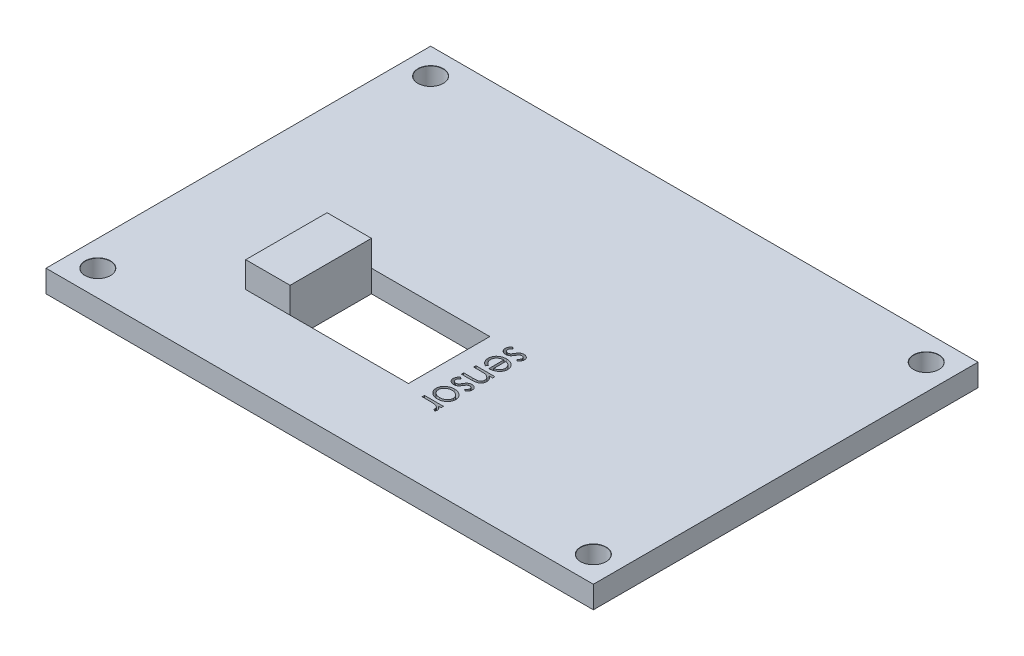
from build123d import *

# Parameters (mm, degrees)
SKETCH1_W                        = 74
SKETCH1_H                        = 52
BOSS_EXTRUDE1_DEPTH              = 3
M3_CLEARANCE_HOLE1_D             = 3.4
M3_CLEARANCE_HOLE1_DEPTH         = 4.5
M3_CLEARANCE_HOLE1_CSINK_D       = 3.45
M3_CLEARANCE_HOLE1_CSINK_ANGLE   = 90
M3_CLEARANCE_HOLE1_TIP           = 1.021463052
SKETCH5_W                        = 16
SKETCH5_H                        = 11
CUT_EXTRUDE1_DEPTH               = 23
SKETCH7_W                        = 6
SKETCH7_H                        = 11
BOSS_EXTRUDE2_DEPTH              = 3.5
M2_5_CLEARANCE_HOLE2_D           = 2.9
M2_5_CLEARANCE_HOLE2_DEPTH       = 5
M2_5_CLEARANCE_HOLE2_CSINK_D     = 2.95
M2_5_CLEARANCE_HOLE2_CSINK_ANGLE = 90
M2_5_CLEARANCE_HOLE2_TIP         = 0.871247898
CUT_EXTRUDE2_DEPTH               = 1


with BuildPart() as part:
    # Sketch1 → Boss-Extrude1 (new body)
    with BuildSketch(Plane(origin=(0, 0, 0), x_dir=(1, 0, 0), z_dir=(0, 1, 0))):
        Rectangle(SKETCH1_W, SKETCH1_H)
    extrude(amount=BOSS_EXTRUDE1_DEPTH)

    # M3 Clearance Hole1
    with Locations(Plane(origin=(0, 3, 0), x_dir=(1, 0, 0), z_dir=(0, 1, 0))):
        with Locations((-33.5, 22.5), (-33.5, -22.5), (33.5, -22.5), (33.5, 22.5)):
            CounterSinkHole(M3_CLEARANCE_HOLE1_D / 2, M3_CLEARANCE_HOLE1_CSINK_D / 2, depth=M3_CLEARANCE_HOLE1_DEPTH, counter_sink_angle=M3_CLEARANCE_HOLE1_CSINK_ANGLE)
            with Locations((0, 0, -(M3_CLEARANCE_HOLE1_DEPTH + M3_CLEARANCE_HOLE1_TIP / 2))):  # 118° drill point
                Cone(0, M3_CLEARANCE_HOLE1_D / 2, M3_CLEARANCE_HOLE1_TIP, mode=Mode.SUBTRACT)

    # Sketch5 → Cut-Extrude1 (cut)
    with BuildSketch(Plane(origin=(0, 3, 0), x_dir=(1, 0, 0), z_dir=(0, 1, 0))):
        with Locations((-7, -9.5)):
            Rectangle(SKETCH5_W, SKETCH5_H)
    extrude(amount=-CUT_EXTRUDE1_DEPTH, mode=Mode.SUBTRACT)

    # Sketch7 → Boss-Extrude2 (add)
    with BuildSketch(Plane(origin=(0, 3, 0), x_dir=(1, 0, 0), z_dir=(0, 1, 0))):
        with Locations((-18, -9.5)):
            Rectangle(SKETCH7_W, SKETCH7_H)
    extrude(amount=BOSS_EXTRUDE2_DEPTH)

    # M2.5 Clearance Hole2
    with Locations(Plane(origin=(0, 0, 0), x_dir=(-1, 0, 0), z_dir=(0, -1, 0))):
        with Locations((19, -6)):
            CounterSinkHole(M2_5_CLEARANCE_HOLE2_D / 2, M2_5_CLEARANCE_HOLE2_CSINK_D / 2, depth=M2_5_CLEARANCE_HOLE2_DEPTH, counter_sink_angle=M2_5_CLEARANCE_HOLE2_CSINK_ANGLE)
            with Locations((0, 0, -(M2_5_CLEARANCE_HOLE2_DEPTH + M2_5_CLEARANCE_HOLE2_TIP / 2))):  # 118° drill point
                Cone(0, M2_5_CLEARANCE_HOLE2_D / 2, M2_5_CLEARANCE_HOLE2_TIP, mode=Mode.SUBTRACT)

    # Sketch14 → Cut-Extrude2 (cut)
    # profile 1 of 6: a face of its own
    with BuildSketch(Plane(origin=(0, 3, 0), x_dir=(1, 0, 0), z_dir=(0, 1, 0))):
        with BuildLine():
            Line((5.713925383, -5.03097691), (5.494474261, -4.843777391))
            add(Edge.make_bspline(
                [(5.494474261, -4.843777391), (5.515784448, -4.825856855), (5.556832378, -4.791338111), (5.611713908, -4.736479415), (5.658182184, -4.681848956), (5.696422524, -4.627755824), (5.726528224, -4.574091737), (5.747795767, -4.520373927), (5.761151642, -4.46675652), (5.762864561, -4.430888026), (5.76370503, -4.413288609)],
                knots=[0, 0, 0, 0, 1.274592799, 2.455135499, 3.548644466, 4.555161242, 5.484465169, 6.358905668, 7.194772355, 8, 8, 8, 8], degree=3))
            add(Edge.make_bspline(
                [(5.76370503, -4.413288609), (5.762631154, -4.391611953), (5.760517627, -4.348949505), (5.739367566, -4.287915875), (5.706947452, -4.231317414), (5.660750029, -4.182638365), (5.60826914, -4.140731123), (5.549070601, -4.110745012), (5.485873996, -4.091372609), (5.441798544, -4.089578667), (5.419454229, -4.088669218)],
                knots=[0, 0, 0, 0, 0.989431907, 1.947329373, 2.925816416, 3.956145657, 5.000994681, 5.98712103, 6.97955893, 8, 8, 8, 8], degree=3))
            add(Edge.make_bspline(
                [(5.419454229, -4.088669218), (5.39926215, -4.089596334), (5.359034548, -4.091443378), (5.29953849, -4.107089947), (5.241734663, -4.132484734), (5.205778555, -4.155910854), (5.187382915, -4.167895981)],
                knots=[0, 0, 0, 0, 0.97148553, 1.935438782, 2.943742038, 4, 4, 4, 4], degree=3))
            add(Edge.make_bspline(
                [(5.187382915, -4.167895981), (5.177627833, -4.17517051), (5.156994093, -4.190557437), (5.127732172, -4.219524952), (5.096345034, -4.252716923), (5.063816862, -4.291829491), (5.030541728, -4.336416008), (4.99620788, -4.38679528), (4.95952469, -4.441767419), (4.935973802, -4.481187866), (4.92376112, -4.501629955)],
                knots=[0, 0, 0, 0, 0.681844013, 1.442221745, 2.304793414, 3.244787667, 4.29358454, 5.424541895, 6.66445591, 8, 8, 8, 8], degree=3))
            add(Edge.make_bspline(
                [(4.92376112, -4.501629955), (4.908496844, -4.526503671), (4.878958855, -4.574636942), (4.833429266, -4.6429191), (4.787861385, -4.70454958), (4.742828046, -4.760324014), (4.698453012, -4.810054098), (4.653755551, -4.853173003), (4.610033108, -4.890664511), (4.579463332, -4.911566737), (4.564786761, -4.92160191)],
                knots=[0, 0, 0, 0, 1.25757375, 2.433538206, 3.535360318, 4.559312813, 5.521998164, 6.405171035, 7.23432147, 8, 8, 8, 8], degree=3))
            add(Edge.make_bspline(
                [(4.564786761, -4.92160191), (4.535074875, -4.938415045), (4.475717546, -4.972003718), (4.378354997, -5.006016139), (4.275661441, -5.026995524), (4.205215135, -5.029633854), (4.169354069, -5.03097691)],
                knots=[0, 0, 0, 0, 0.984436973, 1.96667253, 2.964923853, 4, 4, 4, 4], degree=3))
            add(Edge.make_bspline(
                [(4.169354069, -5.03097691), (4.144085953, -5.030505077), (4.09431302, -5.029575663), (4.021078647, -5.020217691), (3.950960236, -5.004813377), (3.883564989, -4.983595961), (3.819041682, -4.956475833), (3.757840026, -4.922323937), (3.699206732, -4.882967995), (3.644233713, -4.837682096), (3.594156631, -4.787722879), (3.550331952, -4.734239539), (3.513454721, -4.677551886), (3.483354243, -4.617758834), (3.459217723, -4.5551434), (3.442336116, -4.489280799), (3.432504359, -4.420364412), (3.431089916, -4.373356159), (3.430371697, -4.349486525)],
                knots=[0, 0, 0, 0, 1.080990183, 2.129325844, 3.15347647, 4.149949586, 5.149430173, 6.143289453, 7.144770003, 8.168041068, 9.186510088, 10.167552684, 11.121921968, 12.074717509, 13.027670542, 13.988361086, 14.978539299, 16, 16, 16, 16], degree=3))
            add(Edge.make_bspline(
                [(3.430371697, -4.349486525), (3.431375818, -4.317384664), (3.433377319, -4.253396437), (3.451877051, -4.158801751), (3.480706954, -4.066351433), (3.520601652, -3.976880223), (3.570770856, -3.892235574), (3.630887429, -3.814870456), (3.698989409, -3.74447148), (3.750721572, -3.704776569), (3.776725863, -3.684823064)],
                knots=[0, 0, 0, 0, 0.989573484, 1.972504045, 2.962313952, 3.972686715, 4.987987903, 5.990404037, 6.989833111, 8, 8, 8, 8], degree=3))
            Line((3.776725863, -3.684823064), (4.01370503, -3.868516974))
            add(Edge.make_bspline(
                [(4.01370503, -3.868516974), (3.992388056, -3.885951781), (3.951236677, -3.919608824), (3.896057898, -3.973811968), (3.849869388, -4.029206557), (3.811102328, -4.084929873), (3.781663576, -4.14182312), (3.760079199, -4.199394474), (3.746939965, -4.257980788), (3.745293842, -4.297539314), (3.744474261, -4.317234923)],
                knots=[0, 0, 0, 0, 1.219430901, 2.354051827, 3.419706558, 4.410314163, 5.35484724, 6.249024396, 7.128214957, 8, 8, 8, 8], degree=3))
            add(Edge.make_bspline(
                [(3.744474261, -4.317234923), (3.745845603, -4.344073115), (3.748534815, -4.396702995), (3.773230779, -4.471976834), (3.811446996, -4.541730615), (3.865742715, -4.601878092), (3.928418727, -4.653750505), (3.999996467, -4.689030258), (4.075902966, -4.713631728), (4.128954611, -4.715778573), (4.156032754, -4.716874346)],
                knots=[0, 0, 0, 0, 1.00949534, 1.979627371, 2.958171743, 3.988840155, 5.017131362, 6.006571593, 6.982532213, 8, 8, 8, 8], degree=3))
            add(Edge.make_bspline(
                [(4.156032754, -4.716874346), (4.178323837, -4.715970159), (4.222241416, -4.714188743), (4.285916704, -4.698890413), (4.346098079, -4.67440177), (4.381920743, -4.650451554), (4.400023139, -4.638348705)],
                knots=[0, 0, 0, 0, 1.025273956, 2.019980326, 2.999429558, 4, 4, 4, 4], degree=3))
            add(Edge.make_bspline(
                [(4.400023139, -4.638348705), (4.409071703, -4.631053465), (4.428810858, -4.61513913), (4.456815926, -4.585217004), (4.48771532, -4.55037844), (4.520265977, -4.509360124), (4.553407638, -4.461720544), (4.58860468, -4.40811651), (4.625756812, -4.348492471), (4.650649479, -4.306306033), (4.663644934, -4.284282199)],
                knots=[0, 0, 0, 0, 0.628055649, 1.370083424, 2.21210131, 3.147971961, 4.200247531, 5.350348024, 6.616723807, 8, 8, 8, 8], degree=3))
            add(Edge.make_bspline(
                [(4.663644934, -4.284282199), (4.678164342, -4.260315792), (4.706287869, -4.213893795), (4.750464588, -4.148577974), (4.794834794, -4.089687031), (4.838244841, -4.036076896), (4.881469971, -3.988215991), (4.925241801, -3.946739031), (4.968264861, -3.910626852), (4.998361646, -3.890699369), (5.012803588, -3.881137166)],
                knots=[0, 0, 0, 0, 1.250050915, 2.421299963, 3.51612139, 4.53880554, 5.498304292, 6.39070068, 7.22777776, 8, 8, 8, 8], degree=3))
            add(Edge.make_bspline(
                [(5.012803588, -3.881137166), (5.042005962, -3.864427748), (5.100664552, -3.830863665), (5.197937785, -3.799407454), (5.300205609, -3.777434997), (5.37071591, -3.775538244), (5.406834037, -3.774566654)],
                knots=[0, 0, 0, 0, 0.974180598, 1.956829218, 2.953408235, 4, 4, 4, 4], degree=3))
            add(Edge.make_bspline(
                [(5.406834037, -3.774566654), (5.430462862, -3.775083557), (5.476707821, -3.776095212), (5.544547841, -3.784676369), (5.609155664, -3.798946655), (5.671302153, -3.817285198), (5.729571741, -3.843254105), (5.785671468, -3.87318084), (5.837958655, -3.9098879), (5.88699392, -3.951185283), (5.931638638, -3.996256569), (5.970708633, -4.045123721), (6.003387155, -4.097074447), (6.031408137, -4.151455379), (6.052377136, -4.209213516), (6.066853385, -4.269931118), (6.076471329, -4.333288137), (6.077357144, -4.376560426), (6.077807594, -4.398565051)],
                knots=[0, 0, 0, 0, 1.106544246, 2.165663863, 3.196339384, 4.204026465, 5.194439687, 6.179088469, 7.178175954, 8.180377361, 9.178984918, 10.144956361, 11.104642061, 12.049540701, 13.00541004, 13.974539981, 14.970022375, 16, 16, 16, 16], degree=3))
            add(Edge.make_bspline(
                [(6.077807594, -4.398565051), (6.076705012, -4.42482664), (6.074477683, -4.477877741), (6.056702363, -4.5574256), (6.027788766, -4.636748769), (5.986907133, -4.715916514), (5.935515049, -4.795314789), (5.872265038, -4.874545185), (5.798924651, -4.954981591), (5.742915403, -5.005057795), (5.713925383, -5.03097691)],
                knots=[0, 0, 0, 0, 0.83767354, 1.692186424, 2.588965819, 3.526493318, 4.530107962, 5.603187572, 6.759425573, 8, 8, 8, 8], degree=3))
        make_face()
    # profile 2 of 6: a face of its own
    with BuildSketch(Plane(origin=(0, 3, 0), x_dir=(1, 0, 0), z_dir=(0, 1, 0))):
        with BuildLine():
            Line((4.282935799, -7.477891974), (4.136401344, -7.723284602))
            add(Edge.make_bspline(
                [(4.136401344, -7.723284602), (4.097029289, -7.703097244), (4.020715823, -7.6639688), (3.915004168, -7.596801016), (3.820488245, -7.525785488), (3.738388149, -7.448520115), (3.667325996, -7.366600786), (3.604861199, -7.28040054), (3.551753651, -7.189208488), (3.506732002, -7.093050929), (3.472553909, -6.990908339), (3.44796532, -6.882663508), (3.433035343, -6.768073317), (3.431273186, -6.68940923), (3.430371697, -6.649166013)],
                knots=[0, 0, 0, 0, 1.16717717, 2.262298333, 3.300992606, 4.282768172, 5.231436625, 6.159243762, 7.08803444, 8.012493824, 8.956519254, 9.924578845, 10.938249597, 12, 12, 12, 12], degree=3))
            add(Edge.make_bspline(
                [(3.430371697, -6.649166013), (3.431520128, -6.604458451), (3.433761746, -6.51719397), (3.453082786, -6.390204685), (3.484649002, -6.270712689), (3.52863054, -6.158622498), (3.586499837, -6.054439535), (3.655785234, -5.957203994), (3.738992177, -5.868231775), (3.833366276, -5.788007672), (3.934800183, -5.715635066), (4.041349537, -5.65307164), (4.151048348, -5.599612559), (4.263857648, -5.555103288), (4.380122245, -5.52145649), (4.499524233, -5.497737507), (4.622115458, -5.48243169), (4.705199571, -5.480612053), (4.747078428, -5.479694859)],
                knots=[0, 0, 0, 0, 1.089790918, 2.127157792, 3.123915388, 4.098660683, 5.05524143, 6.023214965, 7.003194833, 8.017637841, 9.039275965, 10.038247135, 11.027251055, 12.012602527, 12.991985574, 13.974481355, 14.979029789, 16, 16, 16, 16], degree=3))
            add(Edge.make_bspline(
                [(4.747078428, -5.479694859), (4.786377924, -5.480472927), (4.864247006, -5.482014613), (4.979258175, -5.495223151), (5.091358035, -5.515287136), (5.20016598, -5.544084051), (5.305719609, -5.581287832), (5.407801514, -5.627282006), (5.506883433, -5.680984186), (5.569571345, -5.722948798), (5.601044774, -5.744017775)],
                knots=[0, 0, 0, 0, 1.037955322, 2.056632653, 3.054552807, 4.044494995, 5.026763172, 6.007885755, 6.999828451, 8, 8, 8, 8], degree=3))
            add(Edge.make_bspline(
                [(5.601044774, -5.744017775), (5.638875498, -5.772179668), (5.713060777, -5.827404566), (5.810573393, -5.922301965), (5.893056828, -6.024553466), (5.961110129, -6.133538446), (6.012961551, -6.250584565), (6.051544603, -6.373906279), (6.073161651, -6.504912789), (6.07623824, -6.594402935), (6.077807594, -6.640051429)],
                knots=[0, 0, 0, 0, 1.068622212, 2.095546368, 3.075529915, 4.04178896, 5.000167431, 5.970776925, 6.964903037, 8, 8, 8, 8], degree=3))
            add(Edge.make_bspline(
                [(6.077807594, -6.640051429), (6.076448425, -6.687133477), (6.073779363, -6.779590604), (6.049136182, -6.914311895), (6.009771573, -7.041758712), (5.954850544, -7.162017512), (5.883081768, -7.274552272), (5.795145034, -7.379230658), (5.692556372, -7.477701847), (5.614394061, -7.534412635), (5.574402146, -7.563428833)],
                knots=[0, 0, 0, 0, 1.02844823, 2.019609899, 2.982709647, 3.938299943, 4.900667657, 5.891038968, 6.920945513, 8, 8, 8, 8], degree=3))
            add(Edge.make_bspline(
                [(5.574402146, -7.563428833), (5.544115306, -7.583148539), (5.483415088, -7.62267034), (5.385527171, -7.672362366), (5.282660316, -7.715113734), (5.174103798, -7.750254882), (5.060172017, -7.777617196), (4.940610299, -7.796811385), (4.815605179, -7.809951942), (4.730285832, -7.811989336), (4.686781953, -7.813028192)],
                knots=[0, 0, 0, 0, 0.926290385, 1.856450811, 2.810349228, 3.780787124, 4.779483266, 5.812115659, 6.884409478, 8, 8, 8, 8], degree=3))
            Line((4.686781953, -7.813028192), (4.686781953, -5.793797423))
            add(Edge.make_bspline(
                [(4.686781953, -5.793797423), (4.653077097, -5.79505796), (4.586817246, -5.797536032), (4.490121882, -5.811583887), (4.397752287, -5.830627156), (4.310309139, -5.857987132), (4.228124973, -5.893649364), (4.149603265, -5.934597226), (4.076581764, -5.984409913), (4.008050163, -6.039754015), (3.947023558, -6.10150015), (3.892101744, -6.166026405), (3.846481307, -6.235117427), (3.809005241, -6.307718647), (3.780161069, -6.383732822), (3.759881268, -6.463235317), (3.746756423, -6.5461334), (3.745242848, -6.602841711), (3.744474261, -6.631637968)],
                knots=[0, 0, 0, 0, 1.151551879, 2.263817885, 3.333423249, 4.371325951, 5.38725143, 6.390960548, 7.391934672, 8.402038721, 9.395725498, 10.353641666, 11.292601964, 12.217503998, 13.139886657, 14.063650647, 15.016729413, 16, 16, 16, 16], degree=3))
            add(Edge.make_bspline(
                [(3.744474261, -6.631637968), (3.745103263, -6.659718788), (3.746361092, -6.71587264), (3.757956361, -6.799453631), (3.777039171, -6.881714786), (3.802861407, -6.961913773), (3.834752657, -7.038746665), (3.872722532, -7.110070611), (3.914709236, -7.175876049), (3.963406493, -7.236876364), (4.022161861, -7.296389021), (4.09572254, -7.354902639), (4.183274814, -7.417300841), (4.24829292, -7.456830058), (4.282935799, -7.477891974)],
                knots=[0, 0, 0, 0, 0.95518639, 1.910107873, 2.865062474, 3.825827943, 4.774069364, 5.691941798, 6.572140111, 7.426669854, 8.343335581, 9.411555122, 10.620827491, 12, 12, 12, 12], degree=3))
        make_face()
        with BuildLine():
            add(Edge.make_bspline(
                [(5.000884517, -7.498925628), (5.042478606, -7.48895906), (5.122198513, -7.469856974), (5.233114579, -7.430003928), (5.331792522, -7.38589781), (5.417470972, -7.33291047), (5.493428869, -7.272506028), (5.559699261, -7.202495414), (5.619706813, -7.124676703), (5.669800406, -7.038058491), (5.712327623, -6.9466653), (5.741343907, -6.851018448), (5.760907797, -6.753731946), (5.762770858, -6.687822952), (5.76370503, -6.654774987)],
                knots=[0, 0, 0, 0, 1.241315029, 2.379124576, 3.417805227, 4.374736851, 5.296977, 6.228289518, 7.167729042, 8.144412946, 9.128591931, 10.088239898, 11.041408809, 12, 12, 12, 12], degree=3))
            add(Edge.make_bspline(
                [(5.76370503, -6.654774987), (5.763089866, -6.627629098), (5.761875275, -6.574031849), (5.750489028, -6.495254955), (5.731050213, -6.419611762), (5.705758446, -6.346256875), (5.670432742, -6.276957019), (5.6299404, -6.209416877), (5.580524204, -6.145636881), (5.542970682, -6.106180007), (5.523921376, -6.086165211)],
                knots=[0, 0, 0, 0, 1.026647746, 2.02702864, 3.002800722, 3.978853205, 4.955586324, 5.939775377, 6.954935579, 8, 8, 8, 8], degree=3))
            add(Edge.make_bspline(
                [(5.523921376, -6.086165211), (5.508766749, -6.071824823), (5.477845093, -6.042564548), (5.425310303, -6.00382494), (5.368519855, -5.96627674), (5.305670119, -5.931848141), (5.237086456, -5.900668642), (5.163336545, -5.871944103), (5.084206064, -5.845820241), (5.02923988, -5.830927332), (5.000884517, -5.823244538)],
                knots=[0, 0, 0, 0, 0.844871503, 1.723884476, 2.640765681, 3.603098289, 4.624542049, 5.692238256, 6.809496755, 8, 8, 8, 8], degree=3))
            Line((5.000884517, -5.823244538), (5.000884517, -7.498925628))
        make_face(mode=Mode.SUBTRACT)
    # profile 3 of 6: a face of its own
    with BuildSketch(Plane(origin=(0, 3, 0), x_dir=(1, 0, 0), z_dir=(0, 1, 0))):
        with BuildLine():
            Line((6.032935799, -8.351489731), (6.032935799, -8.665592295))
            Line((6.032935799, -8.665592295), (5.571597658, -8.665592295))
            add(Edge.make_bspline(
                [(5.571597658, -8.665592295), (5.613352036, -8.694205426), (5.693922508, -8.749418163), (5.800511959, -8.84284033), (5.888395766, -8.941705452), (5.958911014, -9.044845393), (6.011992554, -9.152982643), (6.050297039, -9.26528307), (6.073285497, -9.382608192), (6.07629056, -9.462433724), (6.077807594, -9.502731718)],
                knots=[0, 0, 0, 0, 1.186112635, 2.288757738, 3.313576187, 4.280207199, 5.209007013, 6.129166942, 7.055555062, 8, 8, 8, 8], degree=3))
            add(Edge.make_bspline(
                [(6.077807594, -9.502731718), (6.076028163, -9.543298595), (6.072522049, -9.623229785), (6.045520636, -9.739685908), (5.998717709, -9.848392971), (5.935828899, -9.949373015), (5.856666141, -10.039765873), (5.765007834, -10.119236047), (5.65971485, -10.184709039), (5.562471688, -10.228421696), (5.476174402, -10.257599941), (5.401790357, -10.274810272), (5.319412374, -10.291619049), (5.228196558, -10.303303492), (5.128686406, -10.314335796), (5.020351889, -10.32081093), (4.90369871, -10.325128964), (4.82303795, -10.325603791), (4.781433396, -10.325848705)],
                knots=[0, 0, 0, 0, 1.120566247, 2.207914449, 3.281633341, 4.378455526, 5.481895129, 6.59022011, 7.719224545, 8.895782848, 9.528967548, 10.233922004, 11.004094442, 11.851781839, 12.7740701, 13.770858852, 14.85021634, 16, 16, 16, 16], degree=3))
            Line((4.781433396, -10.325848705), (3.475243492, -10.325848705))
            Line((3.475243492, -10.325848705), (3.475243492, -10.011746141))
            Line((3.475243492, -10.011746141), (4.678368492, -10.011746141))
            add(Edge.make_bspline(
                [(4.678368492, -10.011746141), (4.713191744, -10.011881756), (4.779803414, -10.012141168), (4.875151931, -10.010381375), (4.961618618, -10.008881678), (5.039008883, -10.008095882), (5.107226967, -10.004820229), (5.166378314, -10.002273652), (5.216439121, -9.999057633), (5.246753052, -9.995712812), (5.260299581, -9.994218096)],
                knots=[0, 0, 0, 0, 1.434917939, 2.74478331, 3.929469464, 4.998608682, 5.933543807, 6.743407487, 7.438460572, 8, 8, 8, 8], degree=3))
            add(Edge.make_bspline(
                [(5.260299581, -9.994218096), (5.280696497, -9.991794591), (5.320364436, -9.987081356), (5.377120091, -9.973910156), (5.430531631, -9.958730281), (5.479912535, -9.939366212), (5.525319513, -9.915849569), (5.566879949, -9.889384789), (5.604314203, -9.858837318), (5.64936904, -9.814005738), (5.695928255, -9.748666118), (5.735526828, -9.658969471), (5.75993549, -9.55870263), (5.762417377, -9.48815261), (5.76370503, -9.451549827)],
                knots=[0, 0, 0, 0, 0.895074026, 1.740740788, 2.537326204, 3.315175126, 4.049049409, 4.764287123, 5.459867035, 6.151703619, 7.53195692, 8.927924334, 10.406144737, 12, 12, 12, 12], degree=3))
            add(Edge.make_bspline(
                [(5.76370503, -9.451549827), (5.763219829, -9.430018072), (5.762255501, -9.387224127), (5.752844294, -9.323764638), (5.737228009, -9.262149927), (5.716606833, -9.201819109), (5.68739882, -9.144453679), (5.655176379, -9.087006634), (5.614594009, -9.032686446), (5.569237957, -8.980077425), (5.519025834, -8.931194663), (5.466542754, -8.884892792), (5.410060703, -8.844436099), (5.351055427, -8.80785502), (5.289340416, -8.775394646), (5.224276781, -8.748060754), (5.156546186, -8.72489923), (5.109880953, -8.712960385), (5.086421376, -8.706958481)],
                knots=[0, 0, 0, 0, 0.951900127, 1.891883031, 2.829532691, 3.761295011, 4.704398811, 5.672438705, 6.671067516, 7.696982975, 8.742244867, 9.768160327, 10.789587351, 11.810805132, 12.837241228, 13.870163147, 14.929286986, 16, 16, 16, 16], degree=3))
            add(Edge.make_bspline(
                [(5.086421376, -8.706958481), (5.069158786, -8.703498785), (5.031538842, -8.695959154), (4.969923229, -8.68808734), (4.898622037, -8.680970672), (4.817685723, -8.675882283), (4.727039576, -8.67044847), (4.626722892, -8.668358045), (4.516655136, -8.66586157), (4.439989138, -8.665684566), (4.400023139, -8.665592295)],
                knots=[0, 0, 0, 0, 0.613436715, 1.336847711, 2.163535168, 3.110622441, 4.162898823, 5.328117746, 6.607147298, 8, 8, 8, 8], degree=3))
            Line((4.400023139, -8.665592295), (3.475243492, -8.665592295))
            Line((3.475243492, -8.665592295), (3.475243492, -8.351489731))
            Line((3.475243492, -8.351489731), (6.032935799, -8.351489731))
        make_face()
    # profile 4 of 6: a face of its own
    with BuildSketch(Plane(origin=(0, 3, 0), x_dir=(1, 0, 0), z_dir=(0, 1, 0))):
        with BuildLine():
            Line((5.713925383, -12.075848705), (5.494474261, -11.888649186))
            add(Edge.make_bspline(
                [(5.494474261, -11.888649186), (5.515784448, -11.87072865), (5.556832378, -11.836209906), (5.611713908, -11.78135121), (5.658182184, -11.726720751), (5.696422524, -11.672627619), (5.726528224, -11.618963532), (5.747795767, -11.565245722), (5.761151642, -11.511628315), (5.762864561, -11.475759821), (5.76370503, -11.458160404)],
                knots=[0, 0, 0, 0, 1.274592799, 2.455135499, 3.548644466, 4.555161242, 5.484465169, 6.358905668, 7.194772355, 8, 8, 8, 8], degree=3))
            add(Edge.make_bspline(
                [(5.76370503, -11.458160404), (5.762631154, -11.436483748), (5.760517627, -11.393821299), (5.739367566, -11.33278767), (5.706947452, -11.276189208), (5.660750029, -11.227510159), (5.60826914, -11.185602918), (5.549070601, -11.155616807), (5.485873996, -11.136244404), (5.441798544, -11.134450462), (5.419454229, -11.133541013)],
                knots=[0, 0, 0, 0, 0.989431907, 1.947329373, 2.925816416, 3.956145657, 5.000994681, 5.98712103, 6.97955893, 8, 8, 8, 8], degree=3))
            add(Edge.make_bspline(
                [(5.419454229, -11.133541013), (5.39926215, -11.134468129), (5.359034548, -11.136315173), (5.29953849, -11.151961742), (5.241734663, -11.177356528), (5.205778555, -11.200782649), (5.187382915, -11.212767775)],
                knots=[0, 0, 0, 0, 0.97148553, 1.935438782, 2.943742038, 4, 4, 4, 4], degree=3))
            add(Edge.make_bspline(
                [(5.187382915, -11.212767775), (5.177627833, -11.220042305), (5.156994093, -11.235429232), (5.127732172, -11.264396747), (5.096345034, -11.297588717), (5.063816862, -11.336701286), (5.030541728, -11.381287803), (4.99620788, -11.431667074), (4.95952469, -11.486639214), (4.935973802, -11.526059661), (4.92376112, -11.54650175)],
                knots=[0, 0, 0, 0, 0.681844013, 1.442221745, 2.304793414, 3.244787667, 4.29358454, 5.424541895, 6.66445591, 8, 8, 8, 8], degree=3))
            add(Edge.make_bspline(
                [(4.92376112, -11.54650175), (4.908496844, -11.571375466), (4.878958855, -11.619508737), (4.833429266, -11.687790894), (4.787861385, -11.749421375), (4.742828046, -11.805195809), (4.698453012, -11.854925893), (4.653755551, -11.898044798), (4.610033108, -11.935536306), (4.579463332, -11.956438531), (4.564786761, -11.966473705)],
                knots=[0, 0, 0, 0, 1.25757375, 2.433538206, 3.535360318, 4.559312813, 5.521998164, 6.405171035, 7.23432147, 8, 8, 8, 8], degree=3))
            add(Edge.make_bspline(
                [(4.564786761, -11.966473705), (4.535074875, -11.98328684), (4.475717546, -12.016875513), (4.378354997, -12.050887933), (4.275661441, -12.071867319), (4.205215135, -12.074505649), (4.169354069, -12.075848705)],
                knots=[0, 0, 0, 0, 0.984436973, 1.96667253, 2.964923853, 4, 4, 4, 4], degree=3))
            add(Edge.make_bspline(
                [(4.169354069, -12.075848705), (4.144085953, -12.075376871), (4.09431302, -12.074447458), (4.021078647, -12.065089486), (3.950960236, -12.049685172), (3.883564989, -12.028467756), (3.819041682, -12.001347628), (3.757840026, -11.967195731), (3.699206732, -11.92783979), (3.644233713, -11.882553891), (3.594156631, -11.832594674), (3.550331952, -11.779111334), (3.513454721, -11.722423681), (3.483354243, -11.662630629), (3.459217723, -11.600015195), (3.442336116, -11.534152594), (3.432504359, -11.465236207), (3.431089916, -11.418227954), (3.430371697, -11.39435832)],
                knots=[0, 0, 0, 0, 1.080990183, 2.129325844, 3.15347647, 4.149949586, 5.149430173, 6.143289453, 7.144770003, 8.168041068, 9.186510088, 10.167552684, 11.121921968, 12.074717509, 13.027670542, 13.988361086, 14.978539299, 16, 16, 16, 16], degree=3))
            add(Edge.make_bspline(
                [(3.430371697, -11.39435832), (3.431375818, -11.362256459), (3.433377319, -11.298268232), (3.451877051, -11.203673546), (3.480706954, -11.111223228), (3.520601652, -11.021752018), (3.570770856, -10.937107369), (3.630887429, -10.859742251), (3.698989409, -10.789343275), (3.750721572, -10.749648364), (3.776725863, -10.729694859)],
                knots=[0, 0, 0, 0, 0.989573484, 1.972504045, 2.962313952, 3.972686715, 4.987987903, 5.990404037, 6.989833111, 8, 8, 8, 8], degree=3))
            Line((3.776725863, -10.729694859), (4.01370503, -10.913388769))
            add(Edge.make_bspline(
                [(4.01370503, -10.913388769), (3.992388056, -10.930823576), (3.951236677, -10.964480619), (3.896057898, -11.018683763), (3.849869388, -11.074078351), (3.811102328, -11.129801668), (3.781663576, -11.186694915), (3.760079199, -11.244266269), (3.746939965, -11.302852583), (3.745293842, -11.342411109), (3.744474261, -11.362106718)],
                knots=[0, 0, 0, 0, 1.219430901, 2.354051827, 3.419706558, 4.410314163, 5.35484724, 6.249024396, 7.128214957, 8, 8, 8, 8], degree=3))
            add(Edge.make_bspline(
                [(3.744474261, -11.362106718), (3.745845603, -11.38894491), (3.748534815, -11.44157479), (3.773230779, -11.516848629), (3.811446996, -11.58660241), (3.865742715, -11.646749887), (3.928418727, -11.6986223), (3.999996467, -11.733902053), (4.075902966, -11.758503522), (4.128954611, -11.760650367), (4.156032754, -11.761746141)],
                knots=[0, 0, 0, 0, 1.00949534, 1.979627371, 2.958171743, 3.988840155, 5.017131362, 6.006571593, 6.982532213, 8, 8, 8, 8], degree=3))
            add(Edge.make_bspline(
                [(4.156032754, -11.761746141), (4.178323837, -11.760841954), (4.222241416, -11.759060538), (4.285916704, -11.743762207), (4.346098079, -11.719273565), (4.381920743, -11.695323349), (4.400023139, -11.6832205)],
                knots=[0, 0, 0, 0, 1.025273956, 2.019980326, 2.999429558, 4, 4, 4, 4], degree=3))
            add(Edge.make_bspline(
                [(4.400023139, -11.6832205), (4.409071703, -11.67592526), (4.428810858, -11.660010925), (4.456815926, -11.630088799), (4.48771532, -11.595250235), (4.520265977, -11.554231919), (4.553407638, -11.506592339), (4.58860468, -11.452988305), (4.625756812, -11.393364266), (4.650649479, -11.351177828), (4.663644934, -11.329153993)],
                knots=[0, 0, 0, 0, 0.628055649, 1.370083424, 2.21210131, 3.147971961, 4.200247531, 5.350348024, 6.616723807, 8, 8, 8, 8], degree=3))
            add(Edge.make_bspline(
                [(4.663644934, -11.329153993), (4.678164342, -11.305187587), (4.706287869, -11.25876559), (4.750464588, -11.193449769), (4.794834794, -11.134558826), (4.838244841, -11.080948691), (4.881469971, -11.033087786), (4.925241801, -10.991610826), (4.968264861, -10.955498647), (4.998361646, -10.935571164), (5.012803588, -10.926008961)],
                knots=[0, 0, 0, 0, 1.250050915, 2.421299963, 3.51612139, 4.53880554, 5.498304292, 6.39070068, 7.22777776, 8, 8, 8, 8], degree=3))
            add(Edge.make_bspline(
                [(5.012803588, -10.926008961), (5.042005962, -10.909299543), (5.100664552, -10.87573546), (5.197937785, -10.844279249), (5.300205609, -10.822306792), (5.37071591, -10.820410039), (5.406834037, -10.819438449)],
                knots=[0, 0, 0, 0, 0.974180598, 1.956829218, 2.953408235, 4, 4, 4, 4], degree=3))
            add(Edge.make_bspline(
                [(5.406834037, -10.819438449), (5.430462862, -10.819955352), (5.476707821, -10.820967006), (5.544547841, -10.829548164), (5.609155664, -10.84381845), (5.671302153, -10.862156993), (5.729571741, -10.8881259), (5.785671468, -10.918052635), (5.837958655, -10.954759694), (5.88699392, -10.996057078), (5.931638638, -11.041128364), (5.970708633, -11.089995516), (6.003387155, -11.141946242), (6.031408137, -11.196327174), (6.052377136, -11.254085311), (6.066853385, -11.314802913), (6.076471329, -11.378159932), (6.077357144, -11.42143222), (6.077807594, -11.443436846)],
                knots=[0, 0, 0, 0, 1.106544246, 2.165663863, 3.196339384, 4.204026465, 5.194439687, 6.179088469, 7.178175954, 8.180377361, 9.178984918, 10.144956361, 11.104642061, 12.049540701, 13.00541004, 13.974539981, 14.970022375, 16, 16, 16, 16], degree=3))
            add(Edge.make_bspline(
                [(6.077807594, -11.443436846), (6.076705012, -11.469698435), (6.074477683, -11.522749536), (6.056702363, -11.602297395), (6.027788766, -11.681620564), (5.986907133, -11.760788309), (5.935515049, -11.840186584), (5.872265038, -11.91941698), (5.798924651, -11.999853386), (5.742915403, -12.04992959), (5.713925383, -12.075848705)],
                knots=[0, 0, 0, 0, 0.83767354, 1.692186424, 2.588965819, 3.526493318, 4.530107962, 5.603187572, 6.759425573, 8, 8, 8, 8], degree=3))
        make_face()
    # profile 5 of 6: a face of its own
    with BuildSketch(Plane(origin=(0, 3, 0), x_dir=(1, 0, 0), z_dir=(0, 1, 0))):
        with BuildLine():
            add(Edge.make_bspline(
                [(6.077807594, -13.691934442), (6.07678832, -13.734329223), (6.074787994, -13.817528957), (6.053254556, -13.93925759), (6.020667935, -14.055303167), (5.974674524, -14.166163729), (5.914505061, -14.270784887), (5.841719077, -14.370285018), (5.755828836, -14.464362099), (5.690037833, -14.520189833), (5.656433396, -14.548705275)],
                knots=[0, 0, 0, 0, 1.027287364, 2.016050898, 2.988578173, 3.946574519, 4.918969622, 5.90878879, 6.931860386, 8, 8, 8, 8], degree=3))
            add(Edge.make_bspline(
                [(5.656433396, -14.548705275), (5.624133786, -14.573378344), (5.559802982, -14.622519442), (5.456449655, -14.685117544), (5.349274636, -14.739121567), (5.23726119, -14.782643379), (5.120833117, -14.816247219), (5.000001265, -14.839903754), (4.875075627, -14.855215713), (4.790125901, -14.856997223), (4.747078428, -14.857899987)],
                knots=[0, 0, 0, 0, 0.995113039, 1.98195648, 2.954934068, 3.932030009, 4.921378154, 5.919582839, 6.945768189, 8, 8, 8, 8], degree=3))
            add(Edge.make_bspline(
                [(4.747078428, -14.857899987), (4.703792923, -14.85705015), (4.618340803, -14.855372443), (4.492434693, -14.839248669), (4.370391439, -14.814212229), (4.252442568, -14.778597926), (4.138949956, -14.731636906), (4.029406635, -14.675778405), (3.924248913, -14.609097127), (3.824144196, -14.533621312), (3.732096177, -14.449757907), (3.651665846, -14.358662966), (3.582701279, -14.262243732), (3.527532981, -14.159219543), (3.483059261, -14.050892278), (3.452729135, -13.936336985), (3.433945603, -13.815951785), (3.431579281, -13.733838538), (3.430371697, -13.691934442)],
                knots=[0, 0, 0, 0, 1.060148579, 2.09289332, 3.104788584, 4.110181642, 5.106597796, 6.110538386, 7.119382832, 8.153587149, 9.179002847, 10.164831552, 11.126088345, 12.076693812, 13.02204135, 13.98885965, 14.973673297, 16, 16, 16, 16], degree=3))
            add(Edge.make_bspline(
                [(3.430371697, -13.691934442), (3.431598058, -13.650034074), (3.43400794, -13.567697019), (3.452603054, -13.447033314), (3.483260986, -13.332128858), (3.527123726, -13.223513257), (3.583153305, -13.120731259), (3.651416231, -13.023877928), (3.73191699, -12.932730959), (3.824352299, -12.849529807), (3.924441513, -12.774157565), (4.029183654, -12.7065542), (4.139000499, -12.65095512), (4.252288545, -12.603583064), (4.370628016, -12.569410592), (4.49231436, -12.542910234), (4.618359612, -12.527175746), (4.703799247, -12.52544391), (4.747078428, -12.524566654)],
                knots=[0, 0, 0, 0, 1.025726822, 2.015622536, 2.981875737, 3.931977294, 4.876997596, 5.842369055, 6.82762155, 7.848579384, 8.882179216, 9.893499227, 10.896853021, 11.892686777, 12.895844685, 13.908329961, 14.94047107, 16, 16, 16, 16], degree=3))
            add(Edge.make_bspline(
                [(4.747078428, -12.524566654), (4.789891898, -12.525476657), (4.874607241, -12.527277287), (4.999298338, -12.542573696), (5.119917956, -12.566136511), (5.235897485, -12.599774423), (5.347462127, -12.643721827), (5.454817127, -12.696919644), (5.557780955, -12.760200133), (5.622004639, -12.809132485), (5.65433003, -12.833761365)],
                knots=[0, 0, 0, 0, 1.050652086, 2.078933333, 3.079176766, 4.065035565, 5.038784289, 6.018883852, 7.002854527, 8, 8, 8, 8], degree=3))
            add(Edge.make_bspline(
                [(5.65433003, -12.833761365), (5.688216918, -12.862228843), (5.754432324, -12.917854654), (5.840205311, -13.012439047), (5.913935866, -13.111423463), (5.973946066, -13.216659282), (6.020705275, -13.327512912), (6.053313901, -13.444143157), (6.074741367, -13.566112952), (6.076774478, -13.649540916), (6.077807594, -13.691934442)],
                knots=[0, 0, 0, 0, 1.069632259, 2.09007488, 3.080696216, 4.050592567, 5.013525733, 5.983553918, 6.975352444, 8, 8, 8, 8], degree=3))
        make_face()
        with BuildLine():
            add(Edge.make_bspline(
                [(5.76370503, -13.69123332), (5.762738635, -13.662430183), (5.760833425, -13.605645954), (5.746413912, -13.522328771), (5.722928255, -13.442220197), (5.690854231, -13.364747276), (5.648268503, -13.290855932), (5.596510569, -13.220350935), (5.535783065, -13.152622631), (5.466255967, -13.089116031), (5.390447119, -13.030418522), (5.309571745, -12.979284633), (5.225317349, -12.935373209), (5.136589018, -12.900319962), (5.044313682, -12.872091577), (4.947818685, -12.852530517), (4.847603866, -12.841346898), (4.779591541, -12.839572394), (4.744975062, -12.838669218)],
                knots=[0, 0, 0, 0, 0.937921914, 1.849075449, 2.745285246, 3.652997328, 4.573674438, 5.516250315, 6.497479303, 7.531959793, 8.579606852, 9.616605487, 10.644904551, 11.669844489, 12.71989533, 13.784445439, 14.872341182, 16, 16, 16, 16], degree=3))
            add(Edge.make_bspline(
                [(4.744975062, -12.838669218), (4.700242698, -12.839920272), (4.611639184, -12.842398294), (4.481381855, -12.865117581), (4.355578554, -12.900618995), (4.236492635, -12.951108293), (4.126048427, -13.01301154), (4.027032908, -13.08516128), (3.941616095, -13.168131231), (3.871071675, -13.260793754), (3.814176049, -13.360603971), (3.774532664, -13.46671352), (3.748345698, -13.577319575), (3.745774002, -13.652989537), (3.744474261, -13.69123332)],
                knots=[0, 0, 0, 0, 1.100682611, 2.180174213, 3.245755034, 4.313509246, 5.357107255, 6.357343282, 7.321843784, 8.278344858, 9.216297809, 10.139750184, 11.059825202, 12, 12, 12, 12], degree=3))
            add(Edge.make_bspline(
                [(3.744474261, -13.69123332), (3.745773956, -13.729477164), (3.748345559, -13.805147245), (3.774533204, -13.91575242), (3.814174, -14.021865327), (3.871079522, -14.121662706), (3.941586072, -14.214374359), (4.027247893, -14.297253394), (4.125824462, -14.370202554), (4.236358182, -14.432184602), (4.355746259, -14.481669488), (4.481360014, -14.517403865), (4.6116448, -14.540054256), (4.700244582, -14.542541642), (4.744975062, -14.543797423)],
                knots=[0, 0, 0, 0, 0.940080706, 1.860063643, 2.783423598, 3.72128268, 4.677688027, 5.642092001, 6.645648672, 7.689142238, 8.7545698, 9.820043979, 10.899427545, 12, 12, 12, 12], degree=3))
            add(Edge.make_bspline(
                [(4.744975062, -14.543797423), (4.779598801, -14.542969476), (4.847652368, -14.541342131), (4.947790421, -14.529080352), (5.044159358, -14.509451518), (5.136892676, -14.482534436), (5.225132248, -14.446153394), (5.309598359, -14.40255433), (5.390449031, -14.35133507), (5.466221056, -14.292622372), (5.536045079, -14.229141246), (5.596274024, -14.16074023), (5.648329478, -14.090248166), (5.690633477, -14.016456166), (5.723245459, -13.939192348), (5.746175159, -13.859140129), (5.760875742, -13.776136504), (5.762752834, -13.71980746), (5.76370503, -13.69123332)],
                knots=[0, 0, 0, 0, 1.1281935, 2.217484188, 3.282539057, 4.330904233, 5.359183229, 6.387969864, 7.425460194, 8.473603998, 9.50857499, 10.495955477, 11.438978279, 12.360091931, 13.261212209, 14.165160749, 15.069237635, 16, 16, 16, 16], degree=3))
        make_face(mode=Mode.SUBTRACT)
    # profile 6 of 6: a face of its own
    with BuildSketch(Plane(origin=(0, 3, 0), x_dir=(1, 0, 0), z_dir=(0, 1, 0))):
        with BuildLine():
            Line((6.032935799, -15.306617936), (6.032935799, -15.6207205))
            Line((6.032935799, -15.6207205), (5.656433396, -15.6207205))
            add(Edge.make_bspline(
                [(5.656433396, -15.6207205), (5.691390075, -15.641642699), (5.757880535, -15.68143843), (5.847053149, -15.747185623), (5.919987349, -15.815660137), (5.978902351, -15.885448914), (6.022369858, -15.957885133), (6.055221712, -16.030735862), (6.073896759, -16.106136342), (6.076507054, -16.156984645), (6.077807594, -16.182319057)],
                knots=[0, 0, 0, 0, 1.32673917, 2.52356624, 3.600745042, 4.579441891, 5.488212785, 6.343964725, 7.174904979, 8, 8, 8, 8], degree=3))
            add(Edge.make_bspline(
                [(6.077807594, -16.182319057), (6.076586059, -16.201812532), (6.074046239, -16.242343403), (6.056966196, -16.303652225), (6.029221854, -16.366850543), (6.003604093, -16.407232266), (5.99016737, -16.428412807)],
                knots=[0, 0, 0, 0, 0.883007402, 1.835950823, 2.864938628, 4, 4, 4, 4], degree=3))
            Line((5.99016737, -16.428412807), (5.718132113, -16.276269378))
            add(Edge.make_bspline(
                [(5.718132113, -16.276269378), (5.724852048, -16.262562722), (5.737533834, -16.23669567), (5.752839606, -16.198793851), (5.761673266, -16.163793194), (5.763062846, -16.141458831), (5.76370503, -16.131137166)],
                knots=[0, 0, 0, 0, 1.19365047, 2.252644048, 3.192472051, 4, 4, 4, 4], degree=3))
            add(Edge.make_bspline(
                [(5.76370503, -16.131137166), (5.762012158, -16.108249591), (5.758543473, -16.061353099), (5.731419516, -15.992802433), (5.687711194, -15.926707074), (5.628336397, -15.862045945), (5.551393227, -15.801253291), (5.454585768, -15.749992531), (5.34053013, -15.704997537), (5.256854924, -15.683347066), (5.212623299, -15.671902391)],
                knots=[0, 0, 0, 0, 0.712239581, 1.459374255, 2.265878269, 3.173703135, 4.185459487, 5.30732178, 6.576620973, 8, 8, 8, 8], degree=3))
            add(Edge.make_bspline(
                [(5.212623299, -15.671902391), (5.192329144, -15.667715079), (5.147299255, -15.658424022), (5.072130482, -15.648324928), (4.982954093, -15.640520726), (4.880155466, -15.632485627), (4.763483169, -15.627084292), (4.633037653, -15.6241294), (4.488613791, -15.620794987), (4.387639056, -15.620746082), (4.334818812, -15.6207205)],
                knots=[0, 0, 0, 0, 0.564633978, 1.25284376, 2.065383872, 3.004330399, 4.062908326, 5.248078739, 6.560460164, 8, 8, 8, 8], degree=3))
            Line((4.334818812, -15.6207205), (3.475243492, -15.6207205))
            Line((3.475243492, -15.6207205), (3.475243492, -15.306617936))
            Line((3.475243492, -15.306617936), (6.032935799, -15.306617936))
        make_face()
    extrude(amount=-CUT_EXTRUDE2_DEPTH, mode=Mode.SUBTRACT)


solid = part.part
